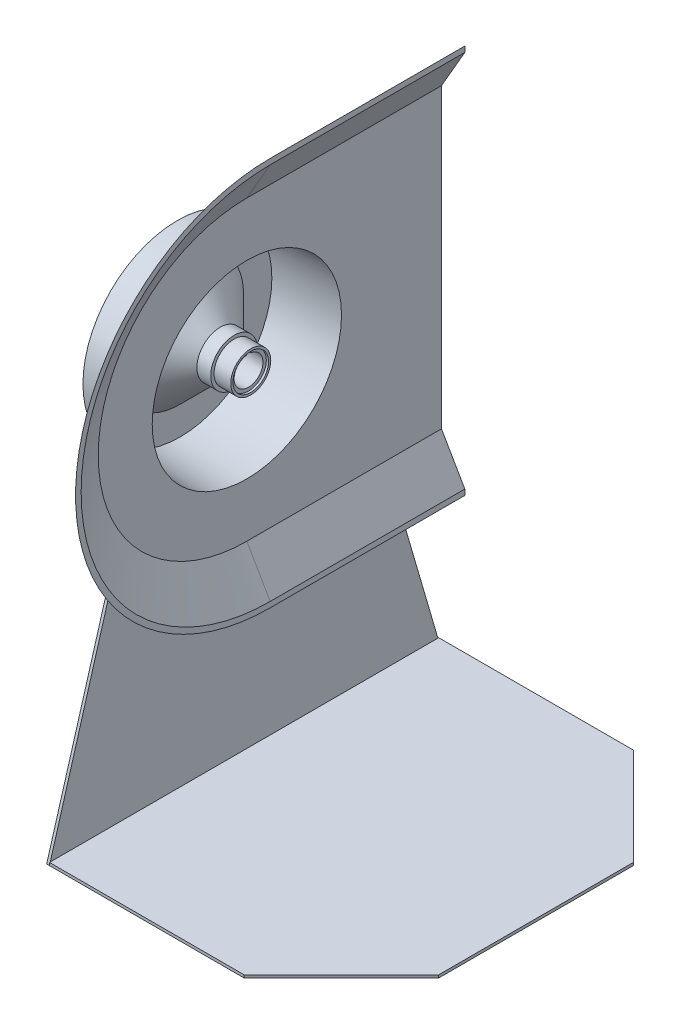
from build123d import *
from build123d.topology import SkipClean

# Parameters (mm, degrees)
REVOLVE1_ANGLE          = 180
SKETCH12_R              = 175
BOSS_EXTRUDE2_DEPTH     = 120
BOSS_EXTRUDE2_TAPER     = 2.5
BOSS_EXTRUDE3_DEPTH     = 350
SKETCH14_R              = 112
CUT_EXTRUDE1_DEPTH      = 32
CUT_EXTRUDE1_DRAFT      = -45
SKETCH17_R              = 31
CUT_EXTRUDE3_DEPTH      = 8
SHELL1_T                = -5
SKETCH15_R              = 26
CUT_EXTRUDE2_DEPTH      = 514.054577993
BOSS_EXTRUDE4_DEPTH     = 5
BOSS_EXTRUDE5_DEPTH     = 5
ENL_V_MAT_EXTRU_2_REACH = 923.154


with BuildPart() as part:
    # Esquisse2 → Revolve1 (revolve)
    with BuildSketch(Plane.XY):
        Polygon((0, 350), (0, 0), (-47, 0), (-47, 268.593612044), align=None)
    revolve(axis=Axis((-47, 0, 0), (1, 0, 0)), revolution_arc=REVOLVE1_ANGLE)

    # Sketch12 → Boss-Extrude2 (add)
    with BuildSketch(Plane.ZY.offset(47)):
        Circle(SKETCH12_R)
    extrude(amount=BOSS_EXTRUDE2_DEPTH, taper=BOSS_EXTRUDE2_TAPER)

    # Sketch13 → Boss-Extrude3 (add)
    with BuildSketch(Plane(origin=(0, 0, 0), x_dir=(-1, 0, 0), z_dir=(0, 0, -1))):
        Polygon((0, 350), (47, 268.593612044), (47, -268.593612044), (0, -350), align=None)
    extrude(amount=BOSS_EXTRUDE3_DEPTH)


with BuildPart() as cut_extrude1_tool:
    # Sketch14 → Cut-Extrude1 (with draft: the straight prism first)
    with BuildSketch(Plane.ZY.offset(167)):
        Circle(SKETCH14_R)
    extrude(amount=-CUT_EXTRUDE1_DEPTH)
    # Cut-Extrude1: the draft: its side faces are tilted about the plane it starts from
    cut_extrude1_sides = [cut_extrude1_tool.faces().sort_by_distance(p)[0] for p in [
        (-151, 0, -112),
    ]]
    draft(cut_extrude1_sides, Plane.ZY.offset(167), CUT_EXTRUDE1_DRAFT)


with BuildPart() as part_1:
    add(part.part)

    # Cut-Extrude1: cut by cut_extrude1_tool
    add(cut_extrude1_tool.part, mode=Mode.SUBTRACT)

    # Sketch17 → Cut-Extrude3 (cut)
    with BuildSketch(Plane.ZY.offset(135)):
        Circle(SKETCH17_R)
    extrude(amount=-CUT_EXTRUDE3_DEPTH, mode=Mode.SUBTRACT)

    # Shell1
    shell1_openings = [part_1.faces().sort_by_distance(p)[0] for p in [
        (-22.469140062, 0, -350),
        (0, 0, -32.672450622),
    ]]
    offset(amount=SHELL1_T, openings=shell1_openings, kind=Kind.INTERSECTION)

    # Sketch15 → Cut-Extrude2 (cut, through all)
    with BuildSketch(Plane.ZY.offset(135)):
        Circle(SKETCH15_R)
    extrude(amount=-CUT_EXTRUDE2_DEPTH, mode=Mode.SUBTRACT)

    # Sketch18 → Revolve2 (revolve)
    with SkipClean():  # the faces are left unmerged after this step: merging them gives an invalid solid
        with BuildSketch(Plane.XY, mode=Mode.PRIVATE) as revolve2_sk:
            Polygon((-130, 82.071067812), (-89.928932188, 42), (-65, 42), (-65, 36), (-35, 36), (-35, 32), (-39, 32), (-39, 26), (-122, 26), (-122, 36), (-130, 36), align=None)
        revolve(revolve2_sk.sketch.rotate(Axis((0, 0, 0), (-1, 0, 0)), 90), axis=Axis((0, 0, 0), (-1, 0, 0)))

    # Sketch20 → Boss-Extrude4 (add)
    with SkipClean():  # the faces are left unmerged after this step: merging them gives an invalid solid
        with BuildSketch(Plane.ZY.offset(47)):
            with BuildLine():
                Line((-350, -600), (350, -600))
                Line((350, -600), (175, 0))
                ThreePointArc((175, 0), (0, -175), (-175, 0))
                Line((-175, 0), (-350, -600))
            make_face()
        extrude(amount=BOSS_EXTRUDE4_DEPTH)

    # Sketch21 → Boss-Extrude5 (add)
    with SkipClean():  # the faces are left unmerged after this step: merging them gives an invalid solid
        with BuildSketch(Plane.XZ.offset(600)):
            Polygon((-47, 350), (-47, -350), (303, -350), (478, -175), (478, 175), (303, 350), align=None)
        extrude(amount=-BOSS_EXTRUDE5_DEPTH)

    # Esquisse3 → Enlèv. mat.-Extru.2 (cut, up to next)
    with BuildSketch(Plane.ZY.offset(127), mode=Mode.PRIVATE) as enl_v_mat_extru_2_sk1:
        Polygon((-4, 30), (4, 30), (4, 26), (4, 25), (-4, 25), (-4, 26), align=None)
    enl_v_mat_extru_2_tool1 = extrude(enl_v_mat_extru_2_sk1.sketch, amount=-ENL_V_MAT_EXTRU_2_REACH, mode=Mode.PRIVATE) & part_1.part
    add(enl_v_mat_extru_2_tool1.solids().sort_by_distance((-127, 27.5, 0))[0], mode=Mode.SUBTRACT)


solid = part_1.part
